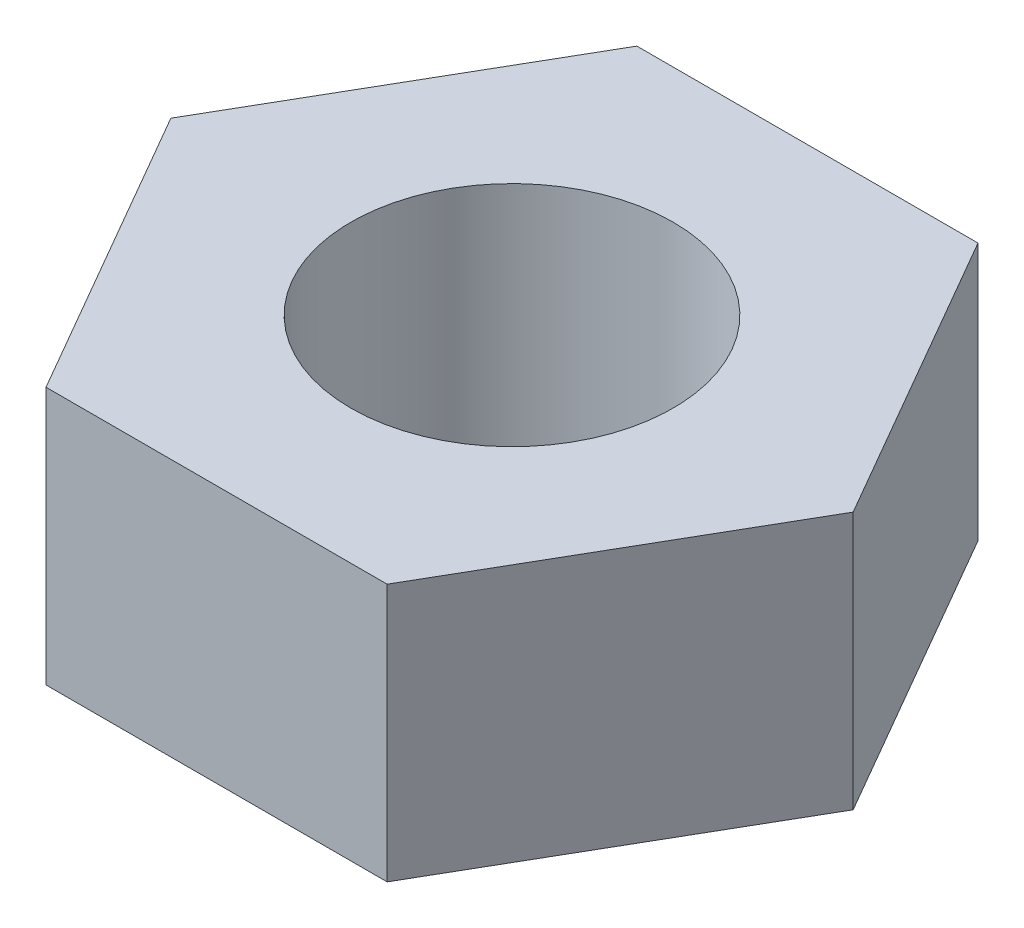
from build123d import *

# Parameters (mm, degrees)
SKETCH1_R           = 1.5
BOSS_EXTRUDE1_DEPTH = 2.4


with BuildPart() as part:
    # Sketch1 → Boss-Extrude1 (new body)
    with BuildSketch(Plane(origin=(0, 0, 0), x_dir=(1, 0, 0), z_dir=(0, 1, 0))):
        Polygon((3.175426481, 0), (1.58771324, 2.75), (-1.58771324, 2.75), (-3.175426481, 0), (-1.58771324, -2.75), (1.58771324, -2.75), align=None)
        with Locations(Location((0, 0, 0), (0, 0, 270))):
            Circle(SKETCH1_R, mode=Mode.SUBTRACT)
    extrude(amount=BOSS_EXTRUDE1_DEPTH)


solid = part.part
